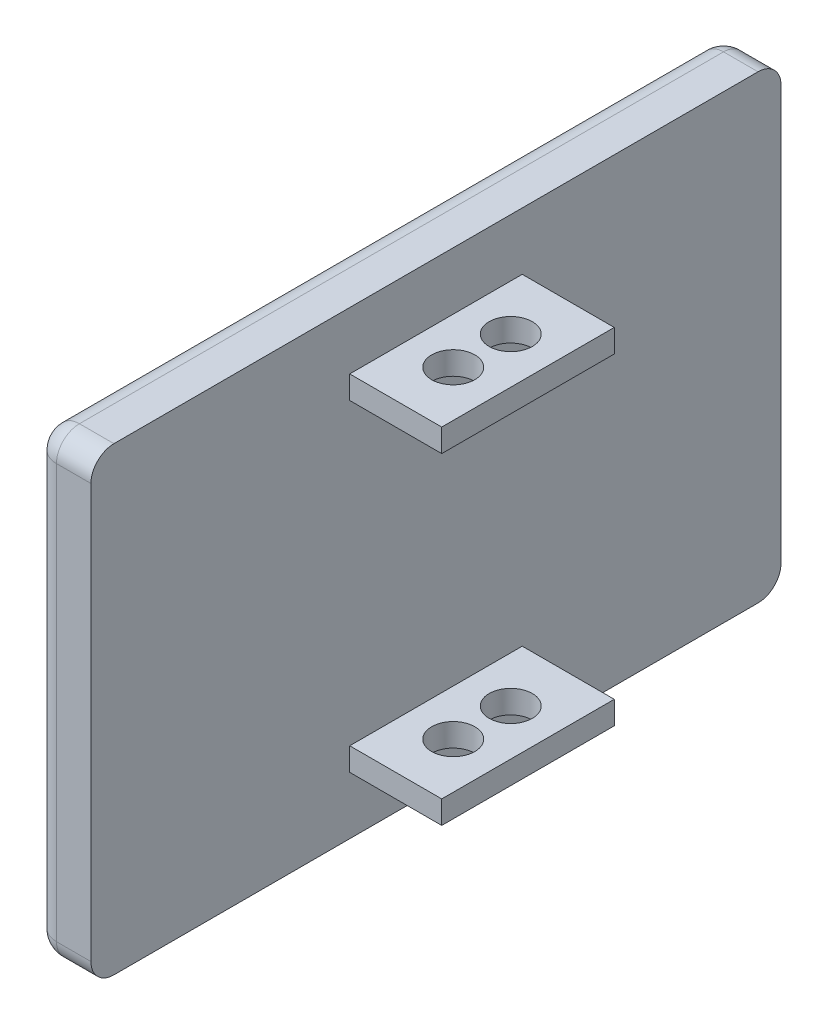
from build123d import *

# Parameters (mm, degrees)
SKETCH1_W           = 76.2
SKETCH1_H           = 50.8
BOSS_EXTRUDE1_DEPTH = 6.35
SKETCH2_W           = 19.05
SKETCH2_H           = 2.54
BOSS_EXTRUDE2_DEPTH = 10.16
FILLET1_R           = 2.54
CUT_EXTRUDE1_REACH  = 62.828
SKETCH3_R           = 2.38125


with BuildPart() as part:
    # Sketch1 → Boss-Extrude1 (new body)
    with BuildSketch(Plane(origin=(0, 0, 0), x_dir=(0, 0, -1), z_dir=(1, 0, 0))):
        Rectangle(SKETCH1_W, SKETCH1_H)
    extrude(amount=BOSS_EXTRUDE1_DEPTH)

    # Sketch2 → Boss-Extrude2 (add)
    with BuildSketch(Plane(origin=(6.35, 0, 0), x_dir=(0, 0, -1), z_dir=(1, 0, 0))):
        with Locations((0, -17.78)):
            Rectangle(SKETCH2_W, SKETCH2_H)
        with Locations((0, 17.78)):
            Rectangle(SKETCH2_W, SKETCH2_H)
    extrude(amount=BOSS_EXTRUDE2_DEPTH)

    # Fillet1
    fillet1_edges = [part.edges().sort_by_distance(p)[0] for p in [
        (0, 25.4, 0),
        (0, 0, -38.1),
        (0, -25.4, 0),
        (0, 0, 38.1),
        (3.175, 25.4, 38.1),
        (3.175, 25.4, -38.1),
        (3.175, -25.4, -38.1),
        (3.175, -25.4, 38.1),
    ]]
    fillet(fillet1_edges, radius=FILLET1_R)

    # Cut-Extrude1: up to this face of the body (flat: up to its plane)
    cut_extrude1_end = Plane(part.part.faces().sort_by_distance((11.43, -19.05, 0))[0])
    # Sketch3 → Cut-Extrude1 (cut, up to the picked face)
    with BuildSketch(Plane(origin=(0, 19.05, 0), x_dir=(1, 0, 0), z_dir=(0, 1, 0)), mode=Mode.PRIVATE) as cut_extrude1_sk1:
        with Locations(Location((11.43, -3.175, 0), (0, 0, 270))):
            Circle(SKETCH3_R)
    cut_extrude1_tool1 = split(extrude(cut_extrude1_sk1.sketch, amount=-CUT_EXTRUDE1_REACH, mode=Mode.PRIVATE), bisect_by=cut_extrude1_end, keep=Keep.BOTH, mode=Mode.PRIVATE)
    # Sketch3 → Cut-Extrude1 (cut, up to the picked face)
    with BuildSketch(Plane(origin=(0, 19.05, 0), x_dir=(1, 0, 0), z_dir=(0, 1, 0)), mode=Mode.PRIVATE) as cut_extrude1_sk2:
        with Locations(Location((11.43, 3.175, 0), (0, 0, 270))):
            Circle(SKETCH3_R)
    cut_extrude1_tool2 = split(extrude(cut_extrude1_sk2.sketch, amount=-CUT_EXTRUDE1_REACH, mode=Mode.PRIVATE), bisect_by=cut_extrude1_end, keep=Keep.BOTH, mode=Mode.PRIVATE)
    add(cut_extrude1_tool1.solids().sort_by(Axis((11.43, 19.05, 3.175), (0, -1, 0)))[0], mode=Mode.SUBTRACT)
    add(cut_extrude1_tool2.solids().sort_by(Axis((11.43, 19.05, -3.175), (0, -1, 0)))[0], mode=Mode.SUBTRACT)


solid = part.part
